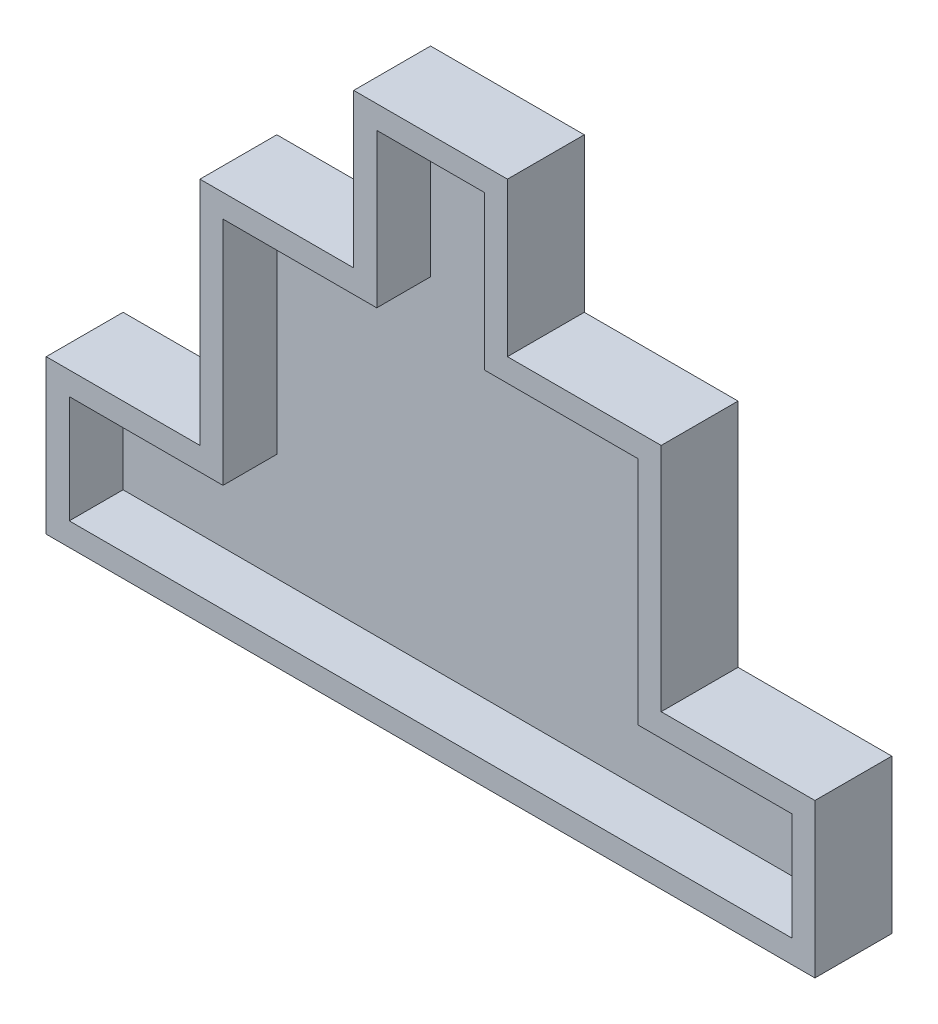
from build123d import *

# Parameters (mm, degrees)
BOSS_EXTRUDE1_DEPTH = 4.5
BOSS_EXTRUDE2_DEPTH = 10.5


with BuildPart() as part:
    # Sketch1 → Boss-Extrude1 (new body)
    with BuildSketch(Plane.XY):
        Polygon((75, 0), (-75, 0), (-75, 30), (-45, 30), (-45, 75), (-15, 75), (-15, 105), (15, 105), (15, 75), (45, 75), (45, 30), (75, 30), align=None)
    extrude(amount=BOSS_EXTRUDE1_DEPTH)

    # Sketch2 → Boss-Extrude2 (add)
    with BuildSketch(Plane.XY.offset(4.5)):
        Polygon((-75, 0), (-75, 30), (-45, 30), (-45, 75), (-15, 75), (-15, 105), (15, 105), (15, 75), (45, 75), (45, 30), (75, 30), (75, 0), align=None)
        Polygon((1.168839967, 4.5), (-70.5, 4.5), (-70.5, 25.5), (-40.5, 25.5), (-40.5, 70.5), (-10.5, 70.5), (-10.5, 100.5), (10.5, 100.5), (10.5, 70.5), (40.5, 70.5), (40.5, 25.5), (70.5, 25.5), (70.5, 4.5), align=None, mode=Mode.SUBTRACT)
    extrude(amount=BOSS_EXTRUDE2_DEPTH)


solid = part.part
